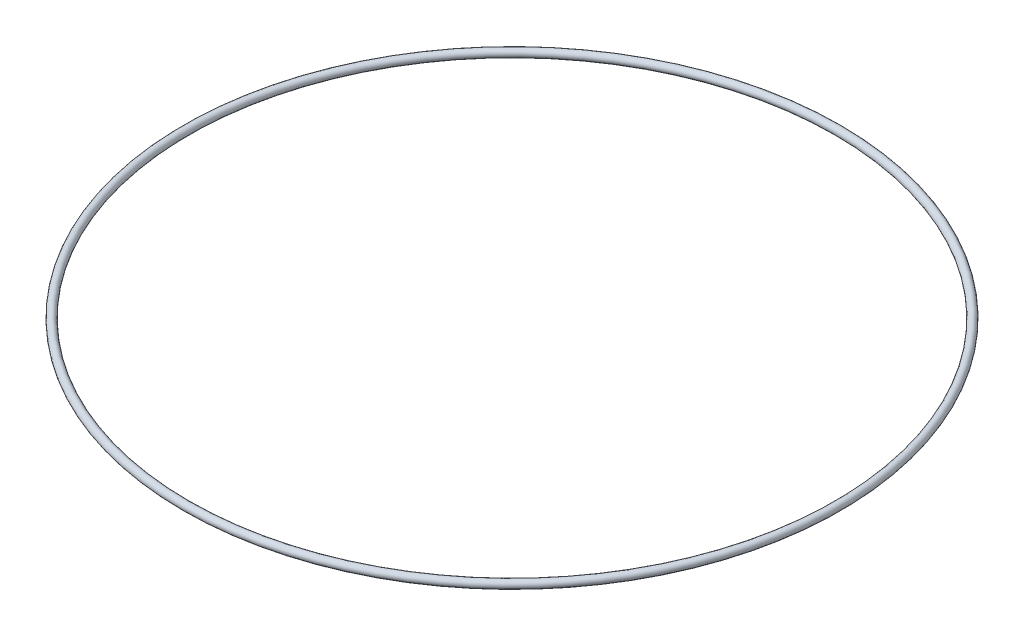
from build123d import *

# Parameters (mm, degrees)
SKETCH2_R = 2.5


with BuildPart() as part:
    # Sketch2 → Revolve1 (revolve)
    with BuildSketch(Plane(origin=(0, 0, 0), x_dir=(0, 0, -1), z_dir=(1, 0, 0))):
        with Locations((205, 0)):
            Circle(SKETCH2_R)
    revolve(axis=Axis((0, 0, 0), (0, 1, 0)))


solid = part.part
